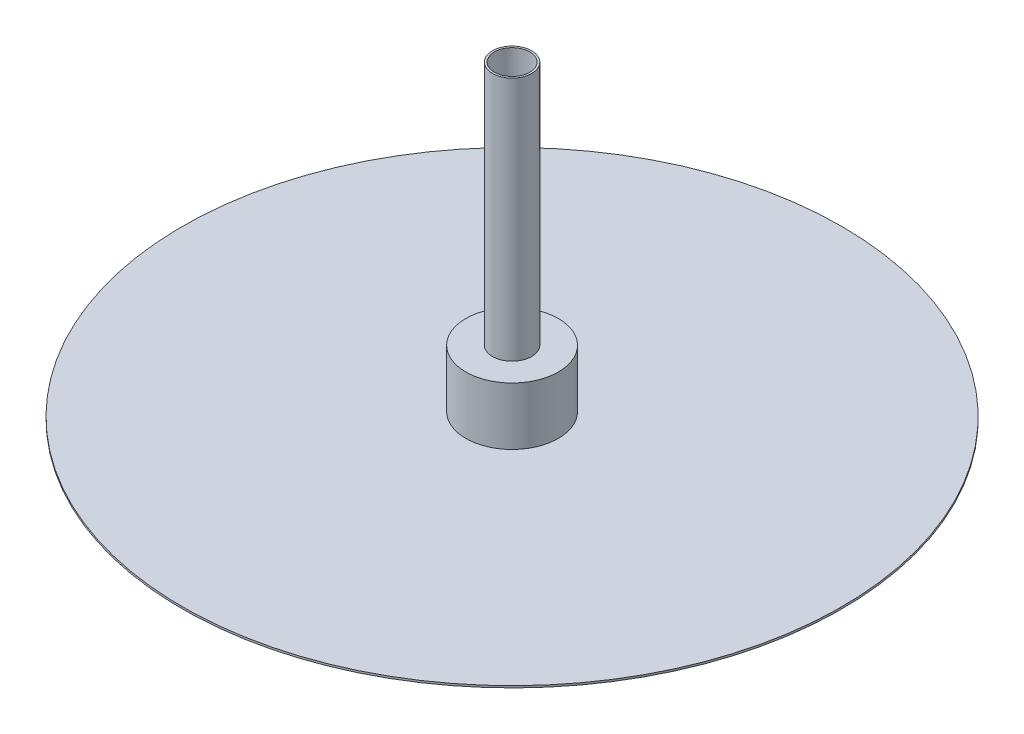
from build123d import *

# Parameters (mm, degrees)
SKETCH6_W          = 500
SKETCH6_H          = 3.175
SKETCH6_W_2        = 3.175
SKETCH6_H_2        = 66.825
SKETCH8_R          = 2.5
CUT_EXTRUDE1_DEPTH = 3.175


with BuildPart() as part:
    # Sketch2 → Revolve1 (revolve)
    with BuildSketch(Plane.XY, mode=Mode.PRIVATE) as revolve1_sk:
        Polygon((-28.575, 500), (-31.75, 500), (-31.75, 103.175), (-74.925, 103.175), (-74.925, 10), (-71.75, 10), (-71.75, 100), (-31.75, 100), (-31.75, -100), (-28.575, -100), align=None)
    revolve(revolve1_sk.sketch.rotate(Axis((0, 0, 0), (0, 1, 0)), 270), axis=Axis((0, 0, 0), (0, 1, 0)))


with BuildPart() as body_2:
    # Sketch6 → Revolve2 (revolve)
    with BuildSketch(Plane.XY, mode=Mode.PRIVATE) as revolve2_sk:
        with Locations((-283.3375, 1.5875)):
            Rectangle(SKETCH6_W, SKETCH6_H)
        Polygon((-36.5125, 3.175), (-33.3375, 3.175), (-33.3375, 96.825), (-36.5125, 96.825), (-36.5125, 13.175), (-36.5125, 10), align=None)
        Polygon((-61.130631236, 10), (-36.5125, 10), (-36.5125, 13.175), (-57.955631236, 13.175), (-61.130631236, 13.175), align=None)
        with Locations((-59.543131236, 46.5875)):
            Rectangle(SKETCH6_W_2, SKETCH6_H_2)
    revolve(revolve2_sk.sketch.rotate(Axis((0, 0, 0), (0, 1, 0)), 270), axis=Axis((0, 0, 0), (0, 1, 0)))

    # Sketch8 → Cut-Extrude1 (cut)
    with BuildSketch(Plane(origin=(0, 13.175, 0), x_dir=(1, 0, 0), z_dir=(0, 1, 0))):
        with Locations(Location((-45, 0, 0), (0, 0, 270))):
            Circle(SKETCH8_R)
    extrude(amount=-CUT_EXTRUDE1_DEPTH, mode=Mode.SUBTRACT)


solid = Compound([part.part, body_2.part])
